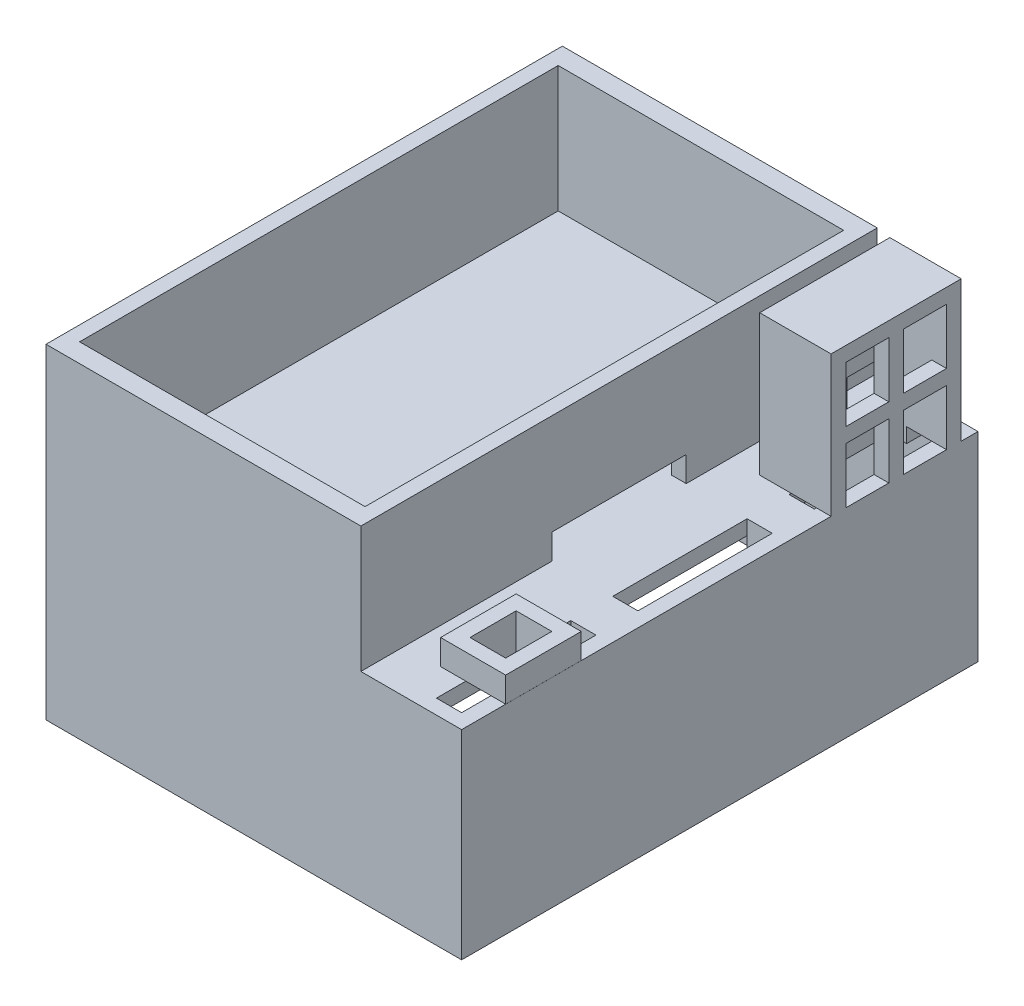
from build123d import *

# Parameters (mm, degrees)
SKETCH1_W               = 49.5
SKETCH1_H               = 61.5
BOSS_EXTRUDE1_DEPTH     = 23.75
SKETCH2_W               = 46
SKETCH2_H               = 58
CUT_EXTRUDE1_DEPTH      = 22
SKETCH3_W               = 3
SKETCH3_H               = 16
CUT_EXTRUDE2_DEPTH      = 1.75
SKETCH7_W               = 3
SKETCH7_H               = 5
BOSS_EXTRUDE2_DEPTH     = 4
SKETCH11_W              = 37.5
SKETCH11_H              = 61.5
BOSS_EXTRUDE3_DEPTH     = 15
SKETCH12_W              = 34
SKETCH12_H              = 57
CUT_EXTRUDE3_DEPTH      = 15
SKETCH14_W              = 7.75
SKETCH14_H              = 9
BOSS_EXTRUDE4_DEPTH     = 3
SKETCH15_W              = 4.25
SKETCH15_H              = 5.5
CUT_EXTRUDE4_DEPTH      = 4.75
SKETCH16_W              = 8.5
SKETCH16_H              = 15.5
BOSS_EXTRUDE5_DEPTH     = 16.75
SKETCH17_W              = 5.125
SKETCH17_H              = 6.625
CUT_EXTRUDE5_DEPTH      = 8.5
CUT_EXTRUDE6_DEPTH      = 15
CUT_EXTRUDE6_DEPTH_BACK = 1.75
SKETCH18_W              = 5
SKETCH18_H              = 12
SKETCH20_W              = 16
SKETCH20_H              = 3
CUT_EXTRUDE7_DEPTH      = 1.75


with BuildPart() as part:
    # Sketch1 → Boss-Extrude1 (new body)
    with BuildSketch(Plane(origin=(0, 0, 0), x_dir=(1, 0, 0), z_dir=(0, 1, 0))):
        with Locations((-113.412024913, -45.391200727)):
            Rectangle(SKETCH1_W, SKETCH1_H)
    extrude(amount=BOSS_EXTRUDE1_DEPTH)

    # Sketch2 → Cut-Extrude1 (cut)
    with BuildSketch(Plane(origin=(0, 0, 0), x_dir=(-1, 0, 0), z_dir=(0, -1, 0))):
        with Locations((113.412024913, -45.391200727)):
            Rectangle(SKETCH2_W, SKETCH2_H)
    extrude(amount=-CUT_EXTRUDE1_DEPTH, mode=Mode.SUBTRACT)

    # Sketch3 → Cut-Extrude2 (cut)
    with BuildSketch(Plane(origin=(0, 22, 0), x_dir=(-1, 0, 0), z_dir=(0, -1, 0))):
        with Locations((91.912024913, -66.391200727)):
            Rectangle(SKETCH3_W, SKETCH3_H)
        with Locations((91.912024913, -24.391200727)):
            Rectangle(SKETCH3_W, SKETCH3_H)
        with Locations((91.912024913, -45.391200727)):
            Rectangle(SKETCH3_W, SKETCH3_H)
    extrude(amount=-CUT_EXTRUDE2_DEPTH, mode=Mode.SUBTRACT)

    # Sketch7 → Boss-Extrude2 (add)
    with BuildSketch(Plane(origin=(0, 22, 0), x_dir=(-1, 0, 0), z_dir=(0, -1, 0))):
        with Locations((91.912024913, -55.891200727)):
            Rectangle(SKETCH7_W, SKETCH7_H)
        with Locations((91.912024913, -34.891200727)):
            Rectangle(SKETCH7_W, SKETCH7_H)
    extrude(amount=BOSS_EXTRUDE2_DEPTH)

    # Sketch11 → Boss-Extrude3 (add)
    with BuildSketch(Plane(origin=(0, 23.75, 0), x_dir=(1, 0, 0), z_dir=(0, 1, 0))):
        with Locations((-119.412024913, -45.391200727)):
            Rectangle(SKETCH11_W, SKETCH11_H)
    extrude(amount=BOSS_EXTRUDE3_DEPTH)

    # Sketch12 → Cut-Extrude3 (cut)
    with BuildSketch(Plane(origin=(0, 38.75, 0), x_dir=(1, 0, 0), z_dir=(0, 1, 0))):
        with Locations((-119.412024913, -45.391200727)):
            Rectangle(SKETCH12_W, SKETCH12_H)
    extrude(amount=-CUT_EXTRUDE3_DEPTH, mode=Mode.SUBTRACT)

    # Sketch14 → Boss-Extrude4 (add)
    with BuildSketch(Plane(origin=(0, 23.75, 0), x_dir=(1, 0, 0), z_dir=(0, 1, 0))):
        with Locations((-92.542024913, -66.391200727)):
            Rectangle(SKETCH14_W, SKETCH14_H)
    extrude(amount=BOSS_EXTRUDE4_DEPTH)

    # Sketch15 → Cut-Extrude4 (cut)
    with BuildSketch(Plane(origin=(0, 26.75, 0), x_dir=(1, 0, 0), z_dir=(0, 1, 0))):
        with Locations((-92.542024913, -66.391200727)):
            Rectangle(SKETCH15_W, SKETCH15_H)
    extrude(amount=-CUT_EXTRUDE4_DEPTH, mode=Mode.SUBTRACT)

    # Sketch16 → Boss-Extrude5 (add)
    with BuildSketch(Plane(origin=(0, 23.75, 0), x_dir=(1, 0, 0), z_dir=(0, 1, 0))):
        with Locations((-92.912024913, -24.391200727)):
            Rectangle(SKETCH16_W, SKETCH16_H)
    extrude(amount=BOSS_EXTRUDE5_DEPTH)

    # Sketch17 → Cut-Extrude5 (cut)
    with BuildSketch(Plane(origin=(-88.662024913, 0, 0), x_dir=(0, 0, -1), z_dir=(1, 0, 0))):
        with Locations((-27.828700727, 35.4375)):
            Rectangle(SKETCH17_W, SKETCH17_H)
        with Locations((-27.828700727, 27.0625)):
            Rectangle(SKETCH17_W, SKETCH17_H)
        with Locations((-20.953700727, 35.4375)):
            Rectangle(SKETCH17_W, SKETCH17_H)
        with Locations((-20.953700727, 27.0625)):
            Rectangle(SKETCH17_W, SKETCH17_H)
    extrude(amount=-CUT_EXTRUDE5_DEPTH, mode=Mode.SUBTRACT)

    # Sketch18 → Cut-Extrude6 (cut, two sides: drawn at the far end of the back side and taken through both)
    with BuildSketch(Plane(origin=(0, 23.75, 0), x_dir=(1, 0, 0), z_dir=(0, 1, 0)).offset(-CUT_EXTRUDE6_DEPTH_BACK)):
        with Locations((-92.912024913, -24.391200727)):
            Rectangle(SKETCH18_W, SKETCH18_H)
    extrude(amount=CUT_EXTRUDE6_DEPTH + CUT_EXTRUDE6_DEPTH_BACK, mode=Mode.SUBTRACT)

    # Sketch20 → Cut-Extrude7 (cut)
    with BuildSketch(Plane(origin=(-100.662024913, 0, 0), x_dir=(0, 0, -1), z_dir=(1, 0, 0))):
        with Locations((-45.391200727, 25.25)):
            Rectangle(SKETCH20_W, SKETCH20_H)
    extrude(amount=-CUT_EXTRUDE7_DEPTH, mode=Mode.SUBTRACT)


solid = part.part
